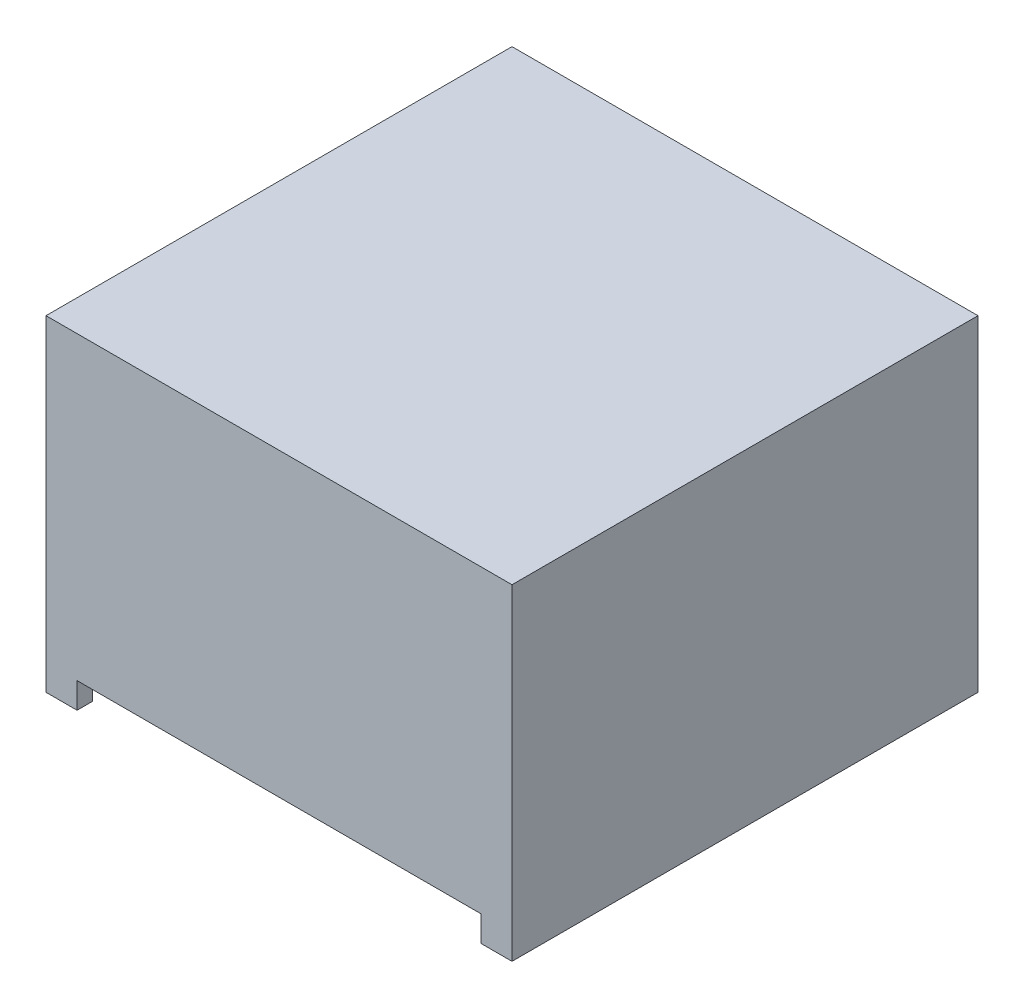
from build123d import *

# Parameters (mm, degrees)
SKETCH_1_W          = 150
SKETCH_1_H          = 150
EXTRUDE_2_DEPTH     = 5
SKETCH_1_3_W        = 150
SKETCH_1_3_H        = 150
SKETCH_1_3_W_2      = 140
SKETCH_1_3_H_2      = 140
EXTRUDE_3_DEPTH     = 100
SKETCH_3_W          = 130
SKETCH_3_H          = 8.266043605
CUT_EXTRUDE_1_DEPTH = 5


with BuildPart() as part:
    # 草图1 → 凸台-拉伸2 (new body)
    with BuildSketch(Plane(origin=(0, 0, 0), x_dir=(1, 0, 0), z_dir=(0, 1, 0))):
        with Locations((-75, -75)):
            Rectangle(SKETCH_1_W, SKETCH_1_H)
    extrude(amount=EXTRUDE_2_DEPTH)

    # 草图1<3> → 凸台-拉伸3 (add)
    with BuildSketch(Plane(origin=(0, 0, 0), x_dir=(1, 0, 0), z_dir=(0, 1, 0))):
        with Locations((-75, -75)):
            Rectangle(SKETCH_1_3_W, SKETCH_1_3_H)
        with Locations((-75, -75)):
            Rectangle(SKETCH_1_3_W_2, SKETCH_1_3_H_2, mode=Mode.SUBTRACT)
    extrude(amount=-EXTRUDE_3_DEPTH)

    # 草图3 → 切除-拉伸1 (cut)
    with BuildSketch(Plane.XY.offset(150)):
        with Locations((-75, -95.866978198)):
            Rectangle(SKETCH_3_W, SKETCH_3_H)
    extrude(amount=-CUT_EXTRUDE_1_DEPTH, mode=Mode.SUBTRACT)


solid = part.part
